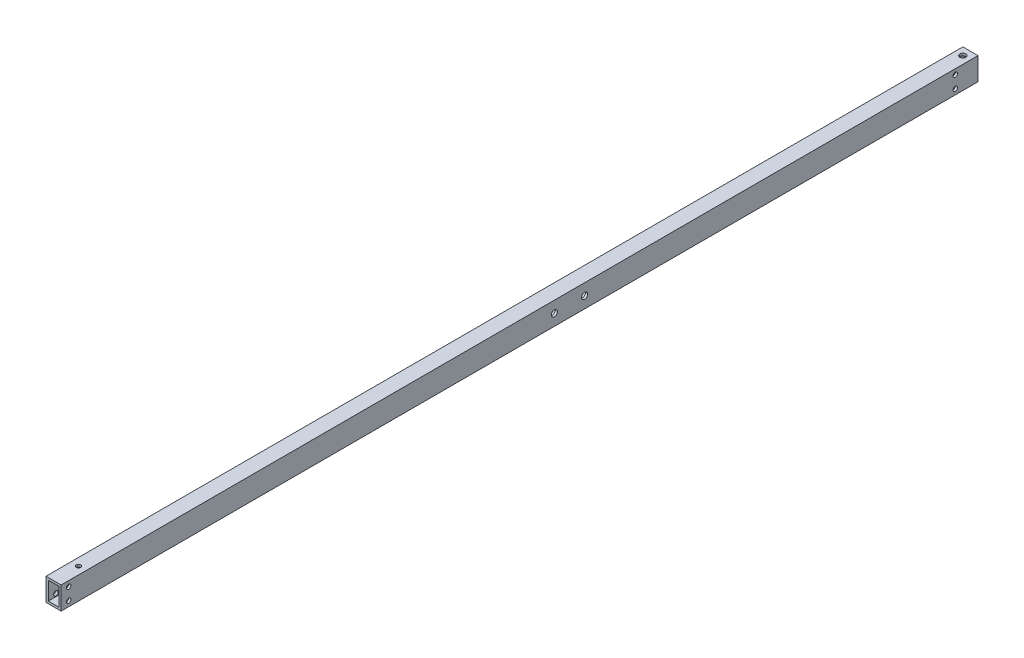
from build123d import *

# Parameters (mm, degrees)
SKETCH_1_W          = 10
SKETCH_1_H          = 15
SKETCH_1_W_2        = 7
SKETCH_1_H_2        = 12
EXTRUDE_1_DEPTH     = 606
SKETCH_2_R          = 2
SKETCH_2_R_2        = 1.5
CUT_EXTRUDE_1_DEPTH = 607.128905432
SKETCH_3_R          = 2
SKETCH_3_R_2        = 1.5
CUT_EXTRUDE_2_DEPTH = 607.206235534


with BuildPart() as part:
    # ｽｹｯﾁ1 → 押し出し-薄板1 (new body)
    with BuildSketch(Plane.XY):
        Rectangle(SKETCH_1_W, SKETCH_1_H)
        Rectangle(SKETCH_1_W_2, SKETCH_1_H_2, mode=Mode.SUBTRACT)
    extrude(amount=EXTRUDE_1_DEPTH)

    # ｽｹｯﾁ2 → ｶｯﾄ - 押し出し1 (cut, through all)
    with BuildSketch(Plane(origin=(5, 0, 0), x_dir=(0, 0, -1), z_dir=(1, 0, 0))):
        with Locations((-280, 0)):
            Circle(SKETCH_2_R)
        with Locations((-260, 0)):
            Circle(SKETCH_2_R)
        with Locations((-15, 4)):
            Circle(SKETCH_2_R_2)
        with Locations((-15, -4)):
            Circle(SKETCH_2_R_2)
        with Locations((-601, 4)):
            Circle(SKETCH_2_R_2)
        with Locations((-601, -4)):
            Circle(SKETCH_2_R_2)
    extrude(amount=-CUT_EXTRUDE_1_DEPTH, mode=Mode.SUBTRACT)

    # ｽｹｯﾁ3 → ｶｯﾄ - 押し出し2 (cut, through all)
    with BuildSketch(Plane(origin=(0, 7.5, 0), x_dir=(1, 0, 0), z_dir=(0, 1, 0))):
        with Locations(Location((0, -5, 0), (0, 0, 270))):
            Circle(SKETCH_3_R)
        with Locations(Location((0, -589.5, 0), (0, 0, 270))):
            Circle(SKETCH_3_R_2)
    extrude(amount=-CUT_EXTRUDE_2_DEPTH, mode=Mode.SUBTRACT)


solid = part.part
